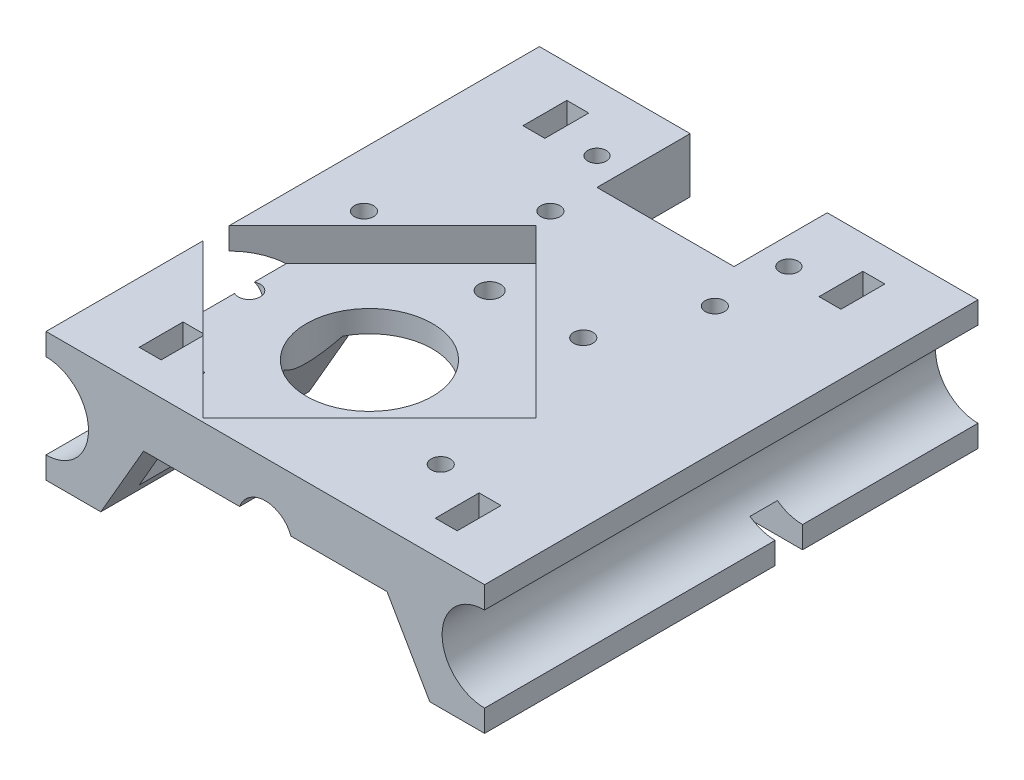
from build123d import *

# Parameters (mm, degrees)
RESSALTO_EXTRUS_O1_DEPTH   = 90
ESBO_O2_R                  = 5
CORTE_EXTRUS_O1_DEPTH      = 6
CORTE_EXTRUS_O2_DEPTH      = 101.031245119
CORTE_EXTRUS_O2_DEPTH_BACK = 101.031245119
ESBO_O3_R                  = 2
ESBO_O3_R_2                = 11.5
ESBO_O3_R_3                = 1.75
ESBO_O3_R_4                = 1.7
ESBO_O3_W                  = 25
ESBO_O3_H                  = 17
CORTE_EXTRUS_O4_START      = 8
ESBO_O4_W                  = 22.305447344
ESBO_O4_H                  = 5
ESBO_O4_W_2                = 48.791448981
CORTE_EXTRUS_O4_DEPTH      = 12
CORTE_EXTRUS_O7_REACH      = 103.253
ESBO_O6_R                  = 8
ESBO_O6_W                  = 20
ESBO_O6_H                  = 20
ESBO_O7_W                  = 4
ESBO_O7_H                  = 8
CORTE_EXTRUS_O8_DEPTH      = 102.253395156
ESBO_O11_R                 = 3.5
ESBO_O11_R_2               = 1.75
RESSALTO_EXTRUS_O3_DEPTH   = 12


with BuildPart() as part:
    # Esboço1 → Ressalto-extrusão1 (new body)
    with BuildSketch(Plane.XY):
        with BuildLine():
            Line((40, 0), (-40, 0))
            Line((-40, 0), (-40, -4))
            ThreePointArc((-40, -4), (-32.25, -11.75), (-40, -19.5))
            Line((-40, -19.5), (-40, -23.5))
            Line((-40, -23.5), (-30, -23.5))
            Line((-30, -23.5), (-22.205771366, -10))
            Line((-22.205771366, -10), (-4.683748499, -10))
            ThreePointArc((-4.683748499, -10), (0, -6.75), (4.683748499, -10))
            Line((4.683748499, -10), (22.205771366, -10))
            Line((22.205771366, -10), (30, -23.5))
            Line((30, -23.5), (40, -23.5))
            Line((40, -23.5), (40, -19.5))
            ThreePointArc((40, -19.5), (32.25, -11.75), (40, -4))
            Line((40, -4), (40, 0))
        make_face()
    extrude(amount=RESSALTO_EXTRUS_O1_DEPTH)

    # Esboço2 → Corte-extrusão1 (cut)
    with BuildSketch(Plane(origin=(0, 0, 0), x_dir=(1, 0, 0), z_dir=(0, 1, 0))):
        Polygon((-42.405591591, -59), (-12, -28.594408409), (18.405591591, -59), (-12, -89.405591591), align=None)
        with Locations(Location((-12, -59, 0), (0, 0, 270))):
            Circle(ESBO_O2_R, mode=Mode.SUBTRACT)
    extrude(amount=-CORTE_EXTRUS_O1_DEPTH, mode=Mode.SUBTRACT)

    # Esboço3 → Corte-extrusão2 (cut, two sides: drawn at the far end of the back side and taken through both)
    with BuildSketch(Plane(origin=(0, -6, 0), x_dir=(1, 0, 0), z_dir=(0, 1, 0)).offset(-CORTE_EXTRUS_O2_DEPTH_BACK)):
        with Locations(Location((-12, -37.079689783, 0), (0, 0, 180))):
            Circle(ESBO_O3_R)
        with Locations(Location((9.920310217, -59, 0), (0, 0, 180))):
            Circle(ESBO_O3_R)
        with Locations(Location((-12, -80.920310217, 0), (0, 0, 180))):
            Circle(ESBO_O3_R)
        with Locations(Location((-33.920310217, -59, 0), (0, 0, 180))):
            Circle(ESBO_O3_R)
        with Locations(Location((-12, -59, 0), (0, 0, 180))):
            Circle(ESBO_O3_R_2)
        with Locations(Location((-30, -42, 0), (0, 0, 180))):
            Circle(ESBO_O3_R_3)
        with Locations(Location((10, -42, 0), (0, 0, 180))):
            Circle(ESBO_O3_R_3)
        with Locations(Location((-17.5, -12, 0), (0, 0, 180))):
            Circle(ESBO_O3_R_4)
        with Locations(Location((17.5, -12, 0), (0, 0, 180))):
            Circle(ESBO_O3_R_4)
        with Locations(Location((17, -75, 0), (0, 0, 180))):
            Circle(ESBO_O3_R_3)
        with Locations(Location((-13, -25, 0), (0, 0, 180))):
            Circle(ESBO_O3_R_3)
        with Locations(Location((17, -25, 0), (0, 0, 180))):
            Circle(ESBO_O3_R_3)
        with Locations((0, -8.5)):
            Rectangle(ESBO_O3_W, ESBO_O3_H)
    extrude(amount=CORTE_EXTRUS_O2_DEPTH + CORTE_EXTRUS_O2_DEPTH_BACK, mode=Mode.SUBTRACT)

    # Esboço4 → Corte-extrusão4 (cut)
    with BuildSketch(Plane.XZ.offset(10).offset(CORTE_EXTRUS_O4_START)):
        with BuildLine():
            Line((-13.998411754, 37), (-22.205771366, 37))
            Line((-22.205771366, 37), (-22.205771366, 32))
            Line((-22.205771366, 32), (-4.683748499, 32))
            Line((-4.683748499, 32), (-4.683748499, 37))
            Line((-4.683748499, 37), (-10.001588246, 37))
            ThreePointArc((-10.001588246, 37), (-12, 35.079689783), (-13.998411754, 37))
        make_face()
        with Locations((-33.358495038, 34.5)):
            Rectangle(ESBO_O4_W, ESBO_O4_H)
        with Locations((19.711975992, 34.5)):
            Rectangle(ESBO_O4_W_2, ESBO_O4_H)
    extrude(amount=CORTE_EXTRUS_O4_DEPTH, mode=Mode.SUBTRACT)

    # Corte-extrusão7: up to this face of the body (flat: up to its plane)
    corte_extrus_o7_end = Plane(part.part.faces().sort_by_distance((-13.702636596, -10, 79.456396835))[0])
    # Esboço6 → Corte-extrusão7 (cut, up to the picked face)
    with BuildSketch(Plane.XZ.offset(23.5), mode=Mode.PRIVATE) as corte_extrus_o7_sk1:
        with Locations((17, 75)):
            Circle(ESBO_O6_R)
    corte_extrus_o7_tool1 = split(extrude(corte_extrus_o7_sk1.sketch, amount=-CORTE_EXTRUS_O7_REACH, mode=Mode.PRIVATE), bisect_by=corte_extrus_o7_end, keep=Keep.BOTH, mode=Mode.PRIVATE)
    # Esboço6 → Corte-extrusão7 (cut, up to the picked face)
    with BuildSketch(Plane.XZ.offset(23.5), mode=Mode.PRIVATE) as corte_extrus_o7_sk2:
        with Locations((17, 25)):
            Circle(ESBO_O6_R)
    corte_extrus_o7_tool2 = split(extrude(corte_extrus_o7_sk2.sketch, amount=-CORTE_EXTRUS_O7_REACH, mode=Mode.PRIVATE), bisect_by=corte_extrus_o7_end, keep=Keep.BOTH, mode=Mode.PRIVATE)
    # Esboço6 → Corte-extrusão7 (cut, up to the picked face)
    with BuildSketch(Plane.XZ.offset(23.5), mode=Mode.PRIVATE) as corte_extrus_o7_sk3:
        with Locations((-13, 25)):
            Circle(ESBO_O6_R)
    corte_extrus_o7_tool3 = split(extrude(corte_extrus_o7_sk3.sketch, amount=-CORTE_EXTRUS_O7_REACH, mode=Mode.PRIVATE), bisect_by=corte_extrus_o7_end, keep=Keep.BOTH, mode=Mode.PRIVATE)
    # Esboço6 → Corte-extrusão7 (cut, up to the picked face)
    with BuildSketch(Plane.XZ.offset(23.5), mode=Mode.PRIVATE) as corte_extrus_o7_sk4:
        with Locations((-30, 42)):
            Rectangle(ESBO_O6_W, ESBO_O6_H)
    corte_extrus_o7_tool4 = split(extrude(corte_extrus_o7_sk4.sketch, amount=-CORTE_EXTRUS_O7_REACH, mode=Mode.PRIVATE), bisect_by=corte_extrus_o7_end, keep=Keep.BOTH, mode=Mode.PRIVATE)
    add(corte_extrus_o7_tool1.solids().sort_by(Axis((17, -23.5, 75), (0, 1, 0)))[0], mode=Mode.SUBTRACT)
    add(corte_extrus_o7_tool2.solids().sort_by(Axis((17, -23.5, 25), (0, 1, 0)))[0], mode=Mode.SUBTRACT)
    add(corte_extrus_o7_tool3.solids().sort_by(Axis((-13, -23.5, 25), (0, 1, 0)))[0], mode=Mode.SUBTRACT)
    add(corte_extrus_o7_tool4.solids().sort_by(Axis((-30, -23.5, 42), (0, 1, 0)))[0], mode=Mode.SUBTRACT)

    # Esboço7 → Corte-extrusão8 (cut, through all)
    with BuildSketch(Plane(origin=(0, 0, 0), x_dir=(1, 0, 0), z_dir=(0, 1, 0))):
        with Locations((27.000875928, -80)):
            Rectangle(ESBO_O7_W, ESBO_O7_H)
        with Locations((27.000875928, -10)):
            Rectangle(ESBO_O7_W, ESBO_O7_H)
        with Locations((-27.000875928, -10)):
            Rectangle(ESBO_O7_W, ESBO_O7_H)
        with Locations((-27.000875928, -80)):
            Rectangle(ESBO_O7_W, ESBO_O7_H)
    extrude(amount=-CORTE_EXTRUS_O8_DEPTH, mode=Mode.SUBTRACT)

    # Esboço11 → Ressalto-extrusão3 (add)
    # profile 1 of 3: a face of its own
    with BuildSketch(Plane.XZ.offset(10)):
        with Locations(Location((-13, 25, 0), (0, 0, 180))):
            Circle(ESBO_O11_R)
        with Locations(Location((-13, 25, 0), (0, 0, 180))):
            Circle(ESBO_O11_R_2, mode=Mode.SUBTRACT)
    # profile 2 of 3: a face of its own
    with BuildSketch(Plane.XZ.offset(10)):
        with Locations(Location((17, 25, 0), (0, 0, 180))):
            Circle(ESBO_O11_R)
        with Locations(Location((17, 25, 0), (0, 0, 180))):
            Circle(ESBO_O11_R_2, mode=Mode.SUBTRACT)
    # profile 3 of 3: a face of its own
    with BuildSketch(Plane.XZ.offset(10)):
        with Locations(Location((17, 75, 0), (0, 0, 180))):
            Circle(ESBO_O11_R)
        with Locations(Location((17, 75, 0), (0, 0, 180))):
            Circle(ESBO_O11_R_2, mode=Mode.SUBTRACT)
    extrude(amount=RESSALTO_EXTRUS_O3_DEPTH)


solid = part.part
